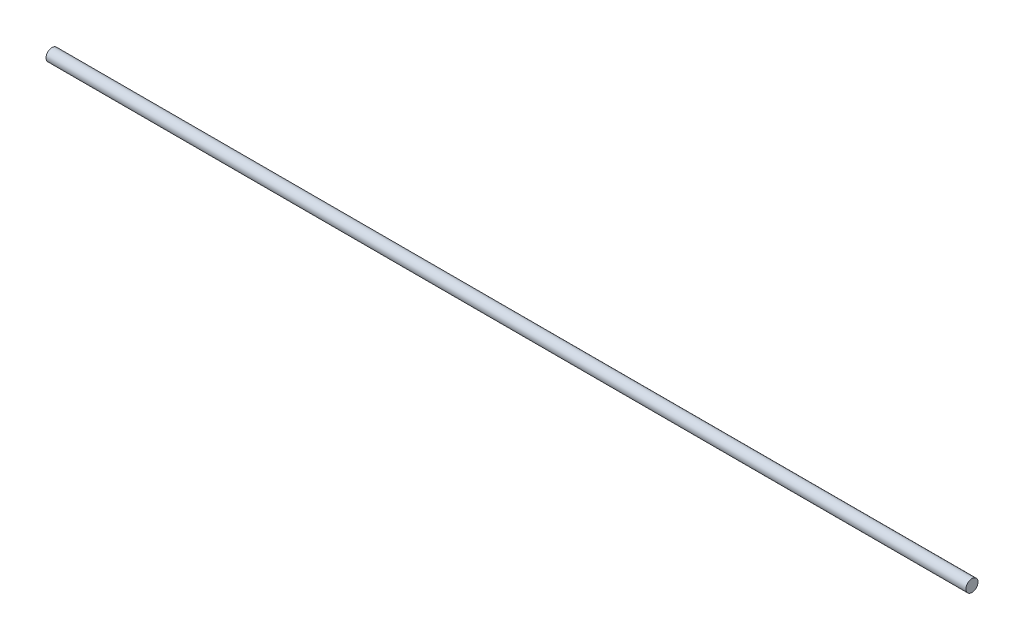
from build123d import *

# Parameters (mm, degrees)
SKETCH1_R           = 6
BOSS_EXTRUDE1_DEPTH = 457.2


with BuildPart() as part:
    # Sketch1 → Boss-Extrude1 (new, symmetric)
    with BuildSketch(Plane(origin=(0, 0, 0), x_dir=(0, 0, -1), z_dir=(1, 0, 0))):
        with Locations(Location((0, 0, 0), (0, 0, 180))):
            Circle(SKETCH1_R)
    extrude(amount=BOSS_EXTRUDE1_DEPTH, both=True)


solid = part.part
